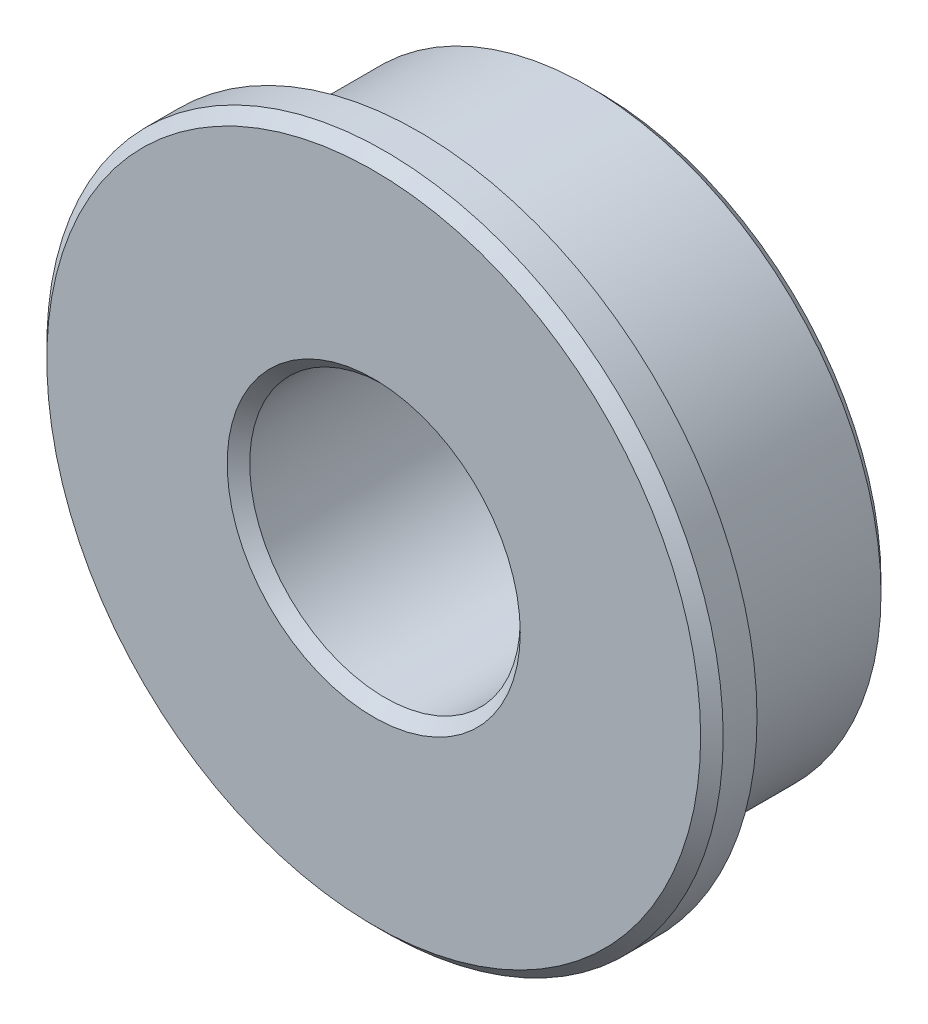
from build123d import *

# Parameters (mm, degrees)
ESQUISSE1_R        = 6.5
ESQUISSE1_R_2      = 3
BOSS_EXTRU_1_DEPTH = 5
BOSS_EXTRU_2_START = -1
ESQUISSE2_R        = 7.5
ESQUISSE2_R_2      = 3
BOSS_EXTRU_2_DEPTH = 1
CHANFREIN1_SIZE    = 0.25


with BuildPart() as part:
    # Esquisse1 → Boss.-Extru.1 (new body)
    with BuildSketch(Plane.XY):
        Circle(ESQUISSE1_R)
        Circle(ESQUISSE1_R_2, mode=Mode.SUBTRACT)
    extrude(amount=BOSS_EXTRU_1_DEPTH)

    # Esquisse2 → Boss.-Extru.2 (add)
    with BuildSketch(Plane.XY.offset(5).offset(BOSS_EXTRU_2_START)):
        Circle(ESQUISSE2_R)
        Circle(ESQUISSE2_R_2, mode=Mode.SUBTRACT)
    extrude(amount=BOSS_EXTRU_2_DEPTH)

    # Chanfrein1
    chanfrein1_edges = [part.edges().sort_by_distance(p)[0] for p in [
        (-7.5, 0, 5),
        (-6.5, 0, 0),
        (-3, 0, 5),
    ]]
    chamfer(chanfrein1_edges, length=CHANFREIN1_SIZE)


solid = part.part
